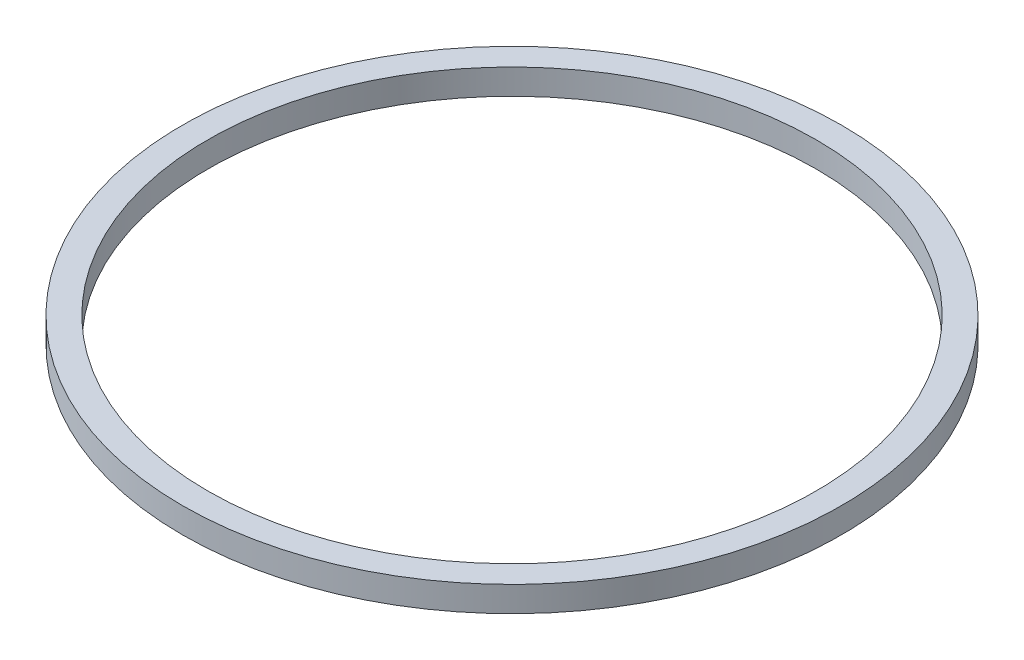
from build123d import *

# Parameters (mm, degrees)
SKETCH1_R           = 75
SKETCH1_R_2         = 62.3
BOSS_EXTRUDE1_DEPTH = 53
BOSS_EXTRUDE3_START = 3
SKETCH3_R           = 75
SKETCH3_R_2         = 47
BOSS_EXTRUDE3_DEPTH = 3
BOSS_EXTRUDE4_START = 14
SKETCH4_R           = 50.1
SKETCH4_R_2         = 47
BOSS_EXTRUDE4_DEPTH = 14
BOSS_EXTRUDE5_START = 1
SKETCH5_R           = 62.3
SKETCH5_R_2         = 50.1
BOSS_EXTRUDE5_DEPTH = 1
CUT_EXTRUDE2_START  = -64
SKETCH6_R           = 75
SKETCH6_R_2         = 67.5
CUT_EXTRUDE2_DEPTH  = 64
BOSS_EXTRUDE6_REACH = 111.186
SKETCH7_R           = 62.3
SKETCH7_R_2         = 60
SKETCH9_R           = 50.1
SKETCH9_R_2         = 47
CUT_EXTRUDE3_DEPTH  = 17
BOSS_EXTRUDE7_START = -4
SKETCH10_R          = 50.1
SKETCH10_R_2        = 48.5
BOSS_EXTRUDE7_DEPTH = 4
SKETCH12_R          = 48.5
SKETCH12_R_2        = 47.6
BOSS_EXTRUDE8_DEPTH = 4
BOSS_EXTRUDE9_START = -17
SKETCH13_R          = 47.6
SKETCH13_R_2        = 45.1
BOSS_EXTRUDE9_DEPTH = 17
SKETCH14_R          = 75.997463879
CUT_EXTRUDE4_DEPTH  = 48
SKETCH15_R          = 79.637366743
SKETCH15_R_2        = 65
CUT_EXTRUDE5_DEPTH  = 50


with BuildPart() as part:
    # Sketch1 → Boss-Extrude1 (new body)
    with BuildSketch(Plane(origin=(0, 0, 0), x_dir=(1, 0, 0), z_dir=(0, 1, 0))):
        with Locations(Location((0, 0, 0), (0, 0, 270))):
            Circle(SKETCH1_R)
        with Locations(Location((0, 0, 0), (0, 0, 270))):
            Circle(SKETCH1_R_2, mode=Mode.SUBTRACT)
    extrude(amount=BOSS_EXTRUDE1_DEPTH)

    # Sketch3 → Boss-Extrude3 (add)
    with BuildSketch(Plane(origin=(0, 20, 0), x_dir=(-1, 0, 0), z_dir=(0, -1, 0)).offset(BOSS_EXTRUDE3_START)):
        with Locations(Location((0, 0, 0), (0, 0, 270))):
            Circle(SKETCH3_R)
        with Locations(Location((0, 0, 0), (0, 0, 90))):
            Circle(SKETCH3_R_2, mode=Mode.SUBTRACT)
    extrude(amount=-BOSS_EXTRUDE3_DEPTH)

    # Sketch4 → Boss-Extrude4 (add)
    with BuildSketch(Plane.XZ.offset(-17).offset(BOSS_EXTRUDE4_START)):
        with Locations(Location((0, 0, 0), (0, 0, 270))):
            Circle(SKETCH4_R)
        with Locations(Location((0, 0, 0), (0, 0, 270))):
            Circle(SKETCH4_R_2, mode=Mode.SUBTRACT)
    extrude(amount=-BOSS_EXTRUDE4_DEPTH)

    # Sketch5 → Boss-Extrude5 (add)
    with BuildSketch(Plane.XZ.offset(-17).offset(BOSS_EXTRUDE5_START)):
        with Locations(Location((0, 0, 0), (0, 0, 270))):
            Circle(SKETCH5_R)
        with Locations(Location((0, 0, 0), (0, 0, 270))):
            Circle(SKETCH5_R_2, mode=Mode.SUBTRACT)
    extrude(amount=-BOSS_EXTRUDE5_DEPTH)

    # Sketch6 → Cut-Extrude2 (cut)
    with BuildSketch(Plane(origin=(0, 53, 0), x_dir=(1, 0, 0), z_dir=(0, 1, 0)).offset(CUT_EXTRUDE2_START)):
        Circle(SKETCH6_R)
        with Locations(Location((0, 0, 0), (0, 0, 270))):
            Circle(SKETCH6_R_2, mode=Mode.SUBTRACT)
    extrude(amount=CUT_EXTRUDE2_DEPTH, mode=Mode.SUBTRACT)

    # Boss-Extrude6: up to this face of the body (flat: up to its plane)
    boss_extrude6_end = Plane(part.part.faces().sort_by_distance((0, 0, -65.590811691))[0])
    # Sketch7 → Boss-Extrude6 (add, up to the picked face)
    with BuildSketch(Plane(origin=(0, 53, 0), x_dir=(1, 0, 0), z_dir=(0, 1, 0)), mode=Mode.PRIVATE) as boss_extrude6_sk1:
        Circle(SKETCH7_R)
        with Locations(Location((0, 0, 0), (0, 0, 270))):
            Circle(SKETCH7_R_2, mode=Mode.SUBTRACT)
    boss_extrude6_tool1 = split(extrude(boss_extrude6_sk1.sketch, amount=-BOSS_EXTRUDE6_REACH, mode=Mode.PRIVATE), bisect_by=boss_extrude6_end, keep=Keep.BOTH, mode=Mode.PRIVATE)
    add(boss_extrude6_tool1.solids().sort_by(Axis((-60.53789, 53, 0), (0, -1, 0)))[0])

    # Sketch9 → Cut-Extrude3 (cut)
    with BuildSketch(Plane.XZ.offset(-3)):
        with Locations(Location((0, 0, 0), (0, 0, 270))):
            Circle(SKETCH9_R)
        Circle(SKETCH9_R_2, mode=Mode.SUBTRACT)
    extrude(amount=-CUT_EXTRUDE3_DEPTH, mode=Mode.SUBTRACT)

    # Sketch10 → Boss-Extrude7 (add)
    with BuildSketch(Plane(origin=(0, 20, 0), x_dir=(1, 0, 0), z_dir=(0, 1, 0)).offset(BOSS_EXTRUDE7_START)):
        Circle(SKETCH10_R)
        with Locations(Location((0, 0, 0), (0, 0, 270))):
            Circle(SKETCH10_R_2, mode=Mode.SUBTRACT)
    extrude(amount=BOSS_EXTRUDE7_DEPTH)

    # Sketch12 → Boss-Extrude8 (add)
    with BuildSketch(Plane.XZ.offset(-16)):
        Circle(SKETCH12_R)
        with Locations(Location((0, 0, 0), (0, 0, 270))):
            Circle(SKETCH12_R_2, mode=Mode.SUBTRACT)
    extrude(amount=-BOSS_EXTRUDE8_DEPTH)

    # Sketch13 → Boss-Extrude9 (add)
    with BuildSketch(Plane(origin=(0, 20, 0), x_dir=(1, 0, 0), z_dir=(0, 1, 0)).offset(BOSS_EXTRUDE9_START)):
        with Locations(Location((0, 0, 0), (0, 0, 270))):
            Circle(SKETCH13_R)
        with Locations(Location((0, 0, 0), (0, 0, 270))):
            Circle(SKETCH13_R_2, mode=Mode.SUBTRACT)
    extrude(amount=BOSS_EXTRUDE9_DEPTH)

    # Sketch14 → Cut-Extrude4 (cut)
    with BuildSketch(Plane.XZ):
        Circle(SKETCH14_R)
    extrude(amount=-CUT_EXTRUDE4_DEPTH, mode=Mode.SUBTRACT)

    # Sketch15 → Cut-Extrude5 (cut)
    with BuildSketch(Plane(origin=(0, 53, 0), x_dir=(1, 0, 0), z_dir=(0, 1, 0))):
        Circle(SKETCH15_R)
        with Locations(Location((0, 0, 0), (0, 0, 270))):
            Circle(SKETCH15_R_2, mode=Mode.SUBTRACT)
    extrude(amount=-CUT_EXTRUDE5_DEPTH, mode=Mode.SUBTRACT)


solid = part.part
